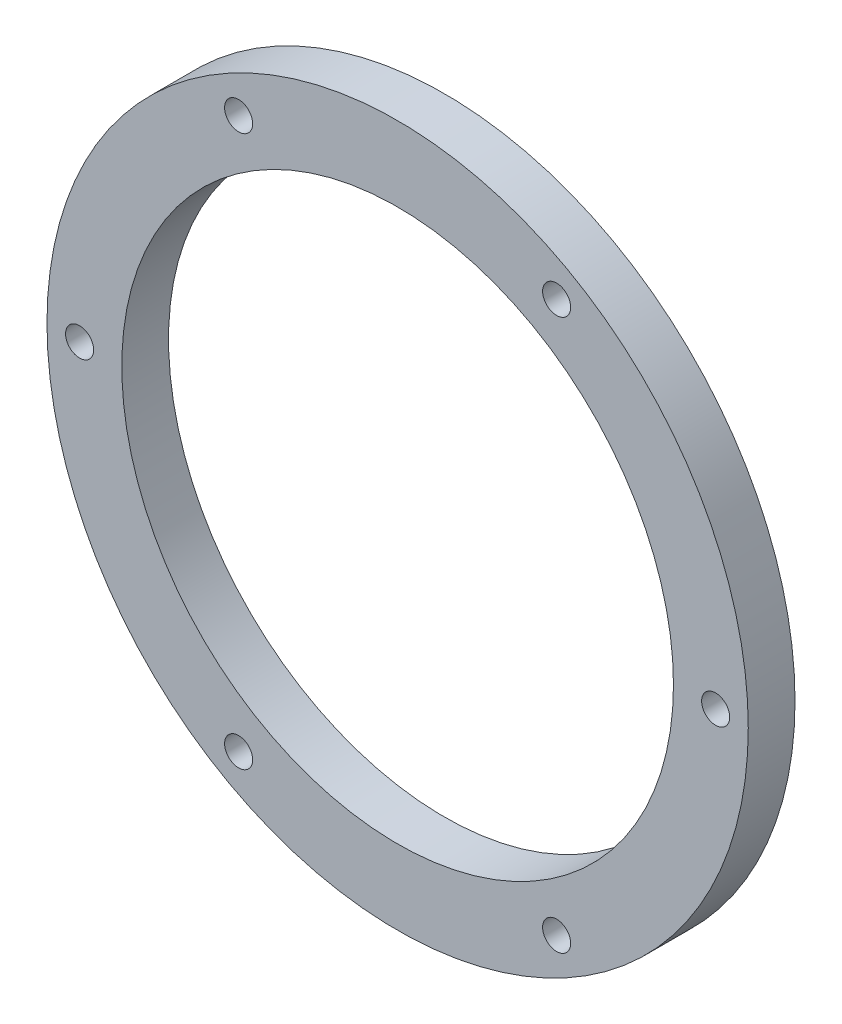
from build123d import *

# Parameters (mm, degrees)
SKETCH1_R           = 37.5
SKETCH1_R_2         = 29.5
BOSS_EXTRUDE1_DEPTH = 5
SKETCH2_R           = 1.5
CUT_EXTRUDE1_DEPTH  = 11


with BuildPart() as part:
    # Sketch1 → Boss-Extrude1 (new body)
    with BuildSketch(Plane.XY):
        Circle(SKETCH1_R)
        Circle(SKETCH1_R_2, mode=Mode.SUBTRACT)
    extrude(amount=BOSS_EXTRUDE1_DEPTH)

    # Sketch2 → Cut-Extrude1 (cut)
    with BuildSketch(Plane(origin=(0, 0, 0), x_dir=(-1, 0, 0), z_dir=(0, 0, -1))):
        with Locations((-17.005, 29.453523983)):
            Circle(SKETCH2_R)
        with Locations((17.005, 29.453523983)):
            Circle(SKETCH2_R)
        with Locations((34.01, 0)):
            Circle(SKETCH2_R)
        with Locations((17.005, -29.453523983)):
            Circle(SKETCH2_R)
        with Locations((-17.005, -29.453523983)):
            Circle(SKETCH2_R)
        with Locations((-34.01, 0)):
            Circle(SKETCH2_R)
    extrude(amount=-CUT_EXTRUDE1_DEPTH, mode=Mode.SUBTRACT)


solid = part.part
